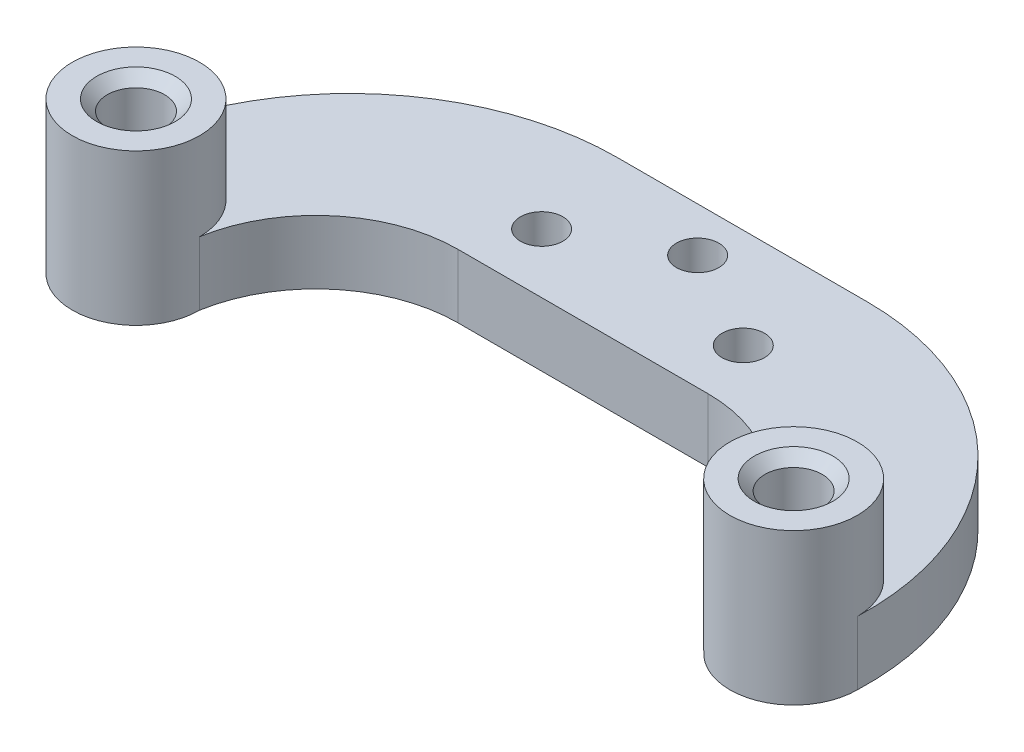
from build123d import *
from build123d.topology import SkipClean

# Parameters (mm, degrees)
SKETCH1_W                = 11.772507028
SKETCH1_H                = 7.5
SKETCH1_R                = 1
SKETCH1_R_2              = 3
SKETCH1_R_3              = 1.35
BOSS_EXTRUDE1_DEPTH      = 3
SKETCH4_W                = 1.65
SKETCH4_H                = 4.12
CHAMFER1_SIZE            = 0.5
CHAMFER1_OF_MIRROR1_SIZE = 0.5


with BuildPart() as part:
    # Sketch1 → Boss-Extrude1 (new body)
    # profile 1 of 5: a face of its own
    with BuildSketch(Plane(origin=(0, 0, 0), x_dir=(1, 0, 0), z_dir=(0, 1, 0))):
        with BuildLine():
            Line((5.886253514, 0), (5.886253514, -7.5))
            ThreePointArc((5.886253514, -7.5), (10.206881736, -9.07831948), (12.492796705, -13.07))
            ThreePointArc((12.492796705, -13.07), (15.492796705, -10.07), (18.492796705, -13.07))
            ThreePointArc((18.492796705, -13.07), (14.965761089, -3.857208203), (5.886253514, 0))
        make_face()
    # profile 2 of 5: a face of its own
    with BuildSketch(Plane(origin=(0, 0, 0), x_dir=(1, 0, 0), z_dir=(0, 1, 0))):
        with Locations((0, -3.75)):
            Rectangle(SKETCH1_W, SKETCH1_H)
        with Locations(Location((0, -2.1, 0), (0, 0, 270))):
            Circle(SKETCH1_R, mode=Mode.SUBTRACT)
        with Locations(Location((4.75, -4.7, 0), (0, 0, 270))):
            Circle(SKETCH1_R, mode=Mode.SUBTRACT)
        with Locations(Location((-4.75, -4.7, 0), (0, 0, 270))):
            Circle(SKETCH1_R, mode=Mode.SUBTRACT)
    # profile 3 of 5: a face of its own
    with BuildSketch(Plane(origin=(0, 0, 0), x_dir=(1, 0, 0), z_dir=(0, 1, 0))):
        with BuildLine():
            ThreePointArc((-12.492796705, -13.07), (-10.206881736, -9.07831948), (-5.886253514, -7.5))
            Line((-5.886253514, -7.5), (-5.886253514, 0))
            ThreePointArc((-5.886253514, 0), (-14.965761089, -3.857208203), (-18.492796705, -13.07))
            ThreePointArc((-18.492796705, -13.07), (-15.492796705, -10.07), (-12.492796705, -13.07))
        make_face()
    # profile 4 of 5: a face of its own
    with BuildSketch(Plane(origin=(0, 0, 0), x_dir=(1, 0, 0), z_dir=(0, 1, 0))):
        with Locations((-15.492796705, -13.07)):
            Circle(SKETCH1_R_2)
        with Locations(Location((-15.492796705, -13.07, 0), (0, 0, 270))):
            Circle(SKETCH1_R_3, mode=Mode.SUBTRACT)
    # profile 5 of 5: a face of its own
    with BuildSketch(Plane(origin=(0, 0, 0), x_dir=(1, 0, 0), z_dir=(0, 1, 0))):
        with Locations((15.492796705, -13.07)):
            Circle(SKETCH1_R_2)
        with Locations(Location((15.492796705, -13.07, 0), (0, 0, 270))):
            Circle(SKETCH1_R_3, mode=Mode.SUBTRACT)
    extrude(amount=BOSS_EXTRUDE1_DEPTH)

    # Sketch4 → Revolve2 (revolve)
    with BuildSketch(Plane.XY.offset(13.07), mode=Mode.PRIVATE) as revolve2_sk:
        with Locations((-17.667796705, 5.06)):
            Rectangle(SKETCH4_W, SKETCH4_H)
    revolve2 = revolve(revolve2_sk.sketch.rotate(Axis((-15.492796705, 3, 13.07), (0, -1, 0)), 180), axis=Axis((-15.492796705, 3, 13.07), (0, -1, 0)))

    # Chamfer1
    chamfer1_edges = [part.edges().sort_by_distance(p)[0] for p in [
        (-16.842796705, 7.12, 13.07),
    ]]
    chamfer(chamfer1_edges, length=CHAMFER1_SIZE)

    # Mirror1: Revolve2 across plane
    with SkipClean():  # the faces are left unmerged after this step: merging them gives an invalid solid
        add(revolve2.mirror(Plane(origin=(0, 0, 0), x_dir=(0, 0, 1), z_dir=(1, 0, 0))))

    # Chamfer1 of Mirror1
    chamfer1_of_mirror1_edges = [part.edges().sort_by_distance(p)[0] for p in [
        (16.842796705, 7.12, 13.07),
    ]]
    chamfer(chamfer1_of_mirror1_edges, length=CHAMFER1_OF_MIRROR1_SIZE)


solid = part.part
